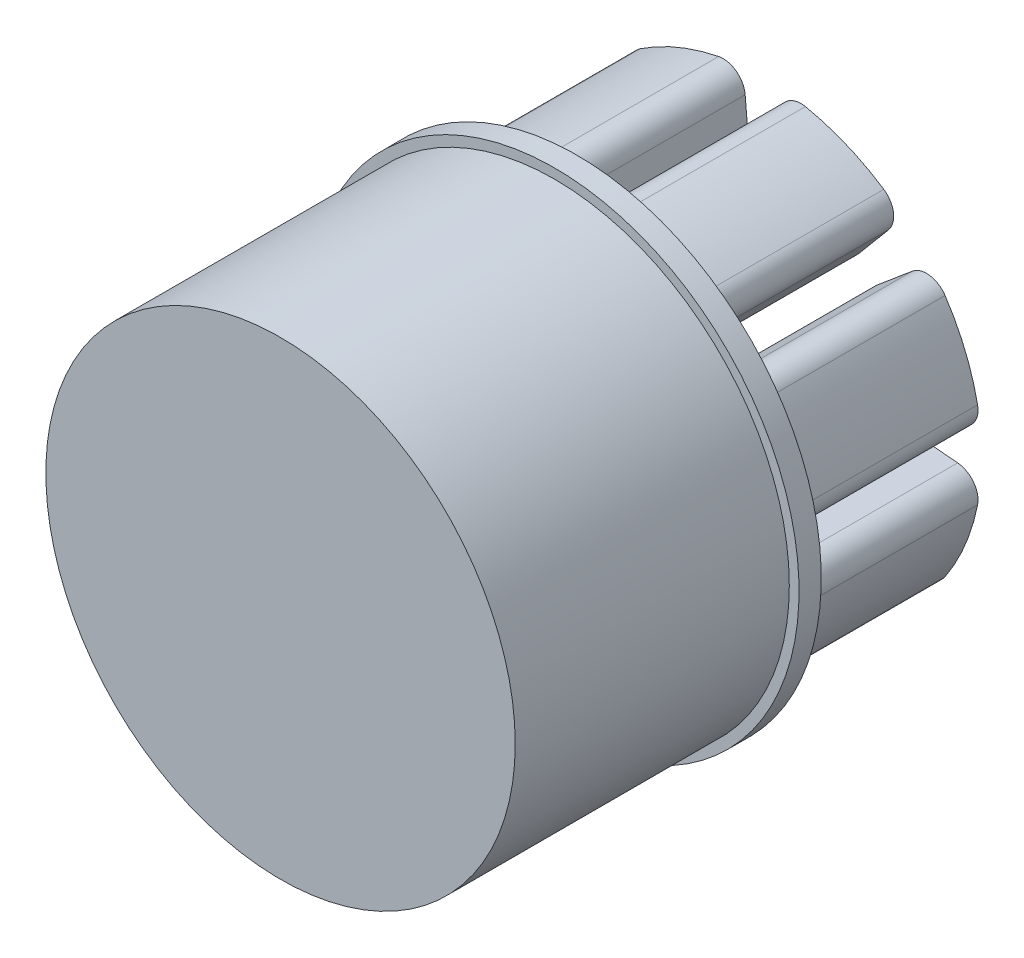
from build123d import *
from build123d.topology import SkipClean

# Parameters (mm, degrees)
BOSS_EXTRUDE1_DEPTH   = 25
BOSS_EXTRUDE1_2_DEPTH = 25
BOSS_EXTRUDE1_3_DEPTH = 25
BOSS_EXTRUDE1_4_DEPTH = 25
BOSS_EXTRUDE1_5_DEPTH = 25
BOSS_EXTRUDE1_6_DEPTH = 25
BOSS_EXTRUDE1_7_DEPTH = 25
BOSS_EXTRUDE1_8_DEPTH = 25
BOSS_EXTRUDE2_START   = -3
SKETCH6_R             = 33
SKETCH6_R_2           = 31.685
BOSS_EXTRUDE2_DEPTH   = 3


with BuildPart() as part:
    # Sketch1 → Boss-Extrude1 (new body)
    with BuildSketch(Plane(origin=(0, 0, 0), x_dir=(-1, 0, 0), z_dir=(0, 0, 1))):
        with BuildLine():
            Line((-1.738225696, 20.20466707), (-2.272785403, 26.41824505))
            ThreePointArc((-2.272785403, 26.41824505), (-3.462351882, 28.561557475), (-5.853284272, 29.102204182))
            ThreePointArc((-5.853284272, 29.102204182), (-11.35995769, 27.425363923), (-16.439468924, 24.717262925))
            ThreePointArc((-16.439468924, 24.717262925), (-17.747818477, 22.644323466), (-17.073418251, 20.287622193))
            Line((-17.073418251, 20.287622193), (-13.05774592, 15.515968274))
            ThreePointArc((-13.05774592, 15.515968274), (-11.238150281, 14.485616628), (-9.187418979, 14.894338942))
            ThreePointArc((-9.187418979, 14.894338942), (-6.696960066, 16.167891819), (-4.035401805, 17.028374328))
            ThreePointArc((-4.035401805, 17.028374328), (-2.296305475, 18.189450019), (-1.738225696, 20.20466707))
        make_face()
    extrude(amount=BOSS_EXTRUDE1_DEPTH)



with BuildPart() as body_2:
    # Sketch1 → Boss-Extrude1 2 (new body)
    with BuildSketch(Plane(origin=(0, 0, 0), x_dir=(-1, 0, 0), z_dir=(0, 0, 1))):
        with BuildLine():
            Line((1.738225696, 20.20466707), (2.272785403, 26.41824505))
            ThreePointArc((2.272785403, 26.41824505), (3.462351882, 28.561557475), (5.853284272, 29.102204182))
            ThreePointArc((5.853284272, 29.102204182), (11.35995769, 27.425363923), (16.439468924, 24.717262925))
            ThreePointArc((16.439468924, 24.717262925), (17.747818477, 22.644323466), (17.073418251, 20.287622193))
            Line((17.073418251, 20.287622193), (13.05774592, 15.515968274))
            ThreePointArc((13.05774592, 15.515968274), (11.238150281, 14.485616628), (9.187418979, 14.894338942))
            ThreePointArc((9.187418979, 14.894338942), (6.696960066, 16.167891819), (4.035401805, 17.028374328))
            ThreePointArc((4.035401805, 17.028374328), (2.296305475, 18.189450019), (1.738225696, 20.20466707))
        make_face()
    extrude(amount=BOSS_EXTRUDE1_2_DEPTH)


with BuildPart() as body_3:
    # Sketch1 → Boss-Extrude1 3 (new body)
    with BuildSketch(Plane(origin=(0, 0, 0), x_dir=(-1, 0, 0), z_dir=(0, 0, 1))):
        with BuildLine():
            Line((15.515968274, 13.05774592), (20.287622193, 17.073418251))
            ThreePointArc((20.287622193, 17.073418251), (22.644323466, 17.747818477), (24.717262925, 16.439468924))
            ThreePointArc((24.717262925, 16.439468924), (27.425363923, 11.35995769), (29.102204182, 5.853284272))
            ThreePointArc((29.102204182, 5.853284272), (28.561557475, 3.462351882), (26.41824505, 2.272785403))
            Line((26.41824505, 2.272785403), (20.20466707, 1.738225696))
            ThreePointArc((20.20466707, 1.738225696), (18.189450019, 2.296305475), (17.028374328, 4.035401805))
            ThreePointArc((17.028374328, 4.035401805), (16.167891819, 6.696960066), (14.894338942, 9.187418979))
            ThreePointArc((14.894338942, 9.187418979), (14.485616628, 11.238150281), (15.515968274, 13.05774592))
        make_face()
    extrude(amount=BOSS_EXTRUDE1_3_DEPTH)


with BuildPart() as body_4:
    # Sketch1 → Boss-Extrude1 4 (new body)
    with BuildSketch(Plane(origin=(0, 0, 0), x_dir=(-1, 0, 0), z_dir=(0, 0, 1))):
        with BuildLine():
            Line((20.20466707, -1.738225696), (26.41824505, -2.272785403))
            ThreePointArc((26.41824505, -2.272785403), (28.561557475, -3.462351882), (29.102204182, -5.853284272))
            ThreePointArc((29.102204182, -5.853284272), (27.425363923, -11.35995769), (24.717262925, -16.439468924))
            ThreePointArc((24.717262925, -16.439468924), (22.644323466, -17.747818477), (20.287622193, -17.073418251))
            Line((20.287622193, -17.073418251), (15.515968274, -13.05774592))
            ThreePointArc((15.515968274, -13.05774592), (14.485616628, -11.238150281), (14.894338942, -9.187418979))
            ThreePointArc((14.894338942, -9.187418979), (16.167891819, -6.696960066), (17.028374328, -4.035401805))
            ThreePointArc((17.028374328, -4.035401805), (18.189450019, -2.296305475), (20.20466707, -1.738225696))
        make_face()
    extrude(amount=BOSS_EXTRUDE1_4_DEPTH)


with BuildPart() as body_5:
    # Sketch1 → Boss-Extrude1 5 (new body)
    with BuildSketch(Plane(origin=(0, 0, 0), x_dir=(-1, 0, 0), z_dir=(0, 0, 1))):
        with BuildLine():
            Line((13.05774592, -15.515968274), (17.073418251, -20.287622193))
            ThreePointArc((17.073418251, -20.287622193), (17.747818477, -22.644323466), (16.439468924, -24.717262925))
            ThreePointArc((16.439468924, -24.717262925), (11.35995769, -27.425363923), (5.853284272, -29.102204182))
            ThreePointArc((5.853284272, -29.102204182), (3.462351882, -28.561557475), (2.272785403, -26.41824505))
            Line((2.272785403, -26.41824505), (1.738225696, -20.20466707))
            ThreePointArc((1.738225696, -20.20466707), (2.296305475, -18.189450019), (4.035401805, -17.028374328))
            ThreePointArc((4.035401805, -17.028374328), (6.696960066, -16.167891819), (9.187418979, -14.894338942))
            ThreePointArc((9.187418979, -14.894338942), (11.238150281, -14.485616628), (13.05774592, -15.515968274))
        make_face()
    extrude(amount=BOSS_EXTRUDE1_5_DEPTH)


with BuildPart() as body_6:
    # Sketch1 → Boss-Extrude1 6 (new body)
    with BuildSketch(Plane(origin=(0, 0, 0), x_dir=(-1, 0, 0), z_dir=(0, 0, 1))):
        with BuildLine():
            Line((-1.738225696, -20.20466707), (-2.272785403, -26.41824505))
            ThreePointArc((-2.272785403, -26.41824505), (-3.462351882, -28.561557475), (-5.853284272, -29.102204182))
            ThreePointArc((-5.853284272, -29.102204182), (-11.35995769, -27.425363923), (-16.439468924, -24.717262925))
            ThreePointArc((-16.439468924, -24.717262925), (-17.747818477, -22.644323466), (-17.073418251, -20.287622193))
            Line((-17.073418251, -20.287622193), (-13.05774592, -15.515968274))
            ThreePointArc((-13.05774592, -15.515968274), (-11.238150281, -14.485616628), (-9.187418979, -14.894338942))
            ThreePointArc((-9.187418979, -14.894338942), (-6.696960066, -16.167891819), (-4.035401805, -17.028374328))
            ThreePointArc((-4.035401805, -17.028374328), (-2.296305475, -18.189450019), (-1.738225696, -20.20466707))
        make_face()
    extrude(amount=BOSS_EXTRUDE1_6_DEPTH)


with BuildPart() as body_7:
    # Sketch1 → Boss-Extrude1 7 (new body)
    with BuildSketch(Plane(origin=(0, 0, 0), x_dir=(-1, 0, 0), z_dir=(0, 0, 1))):
        with BuildLine():
            Line((-15.515968274, -13.05774592), (-20.287622193, -17.073418251))
            ThreePointArc((-20.287622193, -17.073418251), (-22.644323466, -17.747818477), (-24.717262925, -16.439468924))
            ThreePointArc((-24.717262925, -16.439468924), (-27.425363923, -11.35995769), (-29.102204182, -5.853284272))
            ThreePointArc((-29.102204182, -5.853284272), (-28.561557475, -3.462351882), (-26.41824505, -2.272785403))
            Line((-26.41824505, -2.272785403), (-20.20466707, -1.738225696))
            ThreePointArc((-20.20466707, -1.738225696), (-18.189450019, -2.296305475), (-17.028374328, -4.035401805))
            ThreePointArc((-17.028374328, -4.035401805), (-16.167891819, -6.696960066), (-14.894338942, -9.187418979))
            ThreePointArc((-14.894338942, -9.187418979), (-14.485616628, -11.238150281), (-15.515968274, -13.05774592))
        make_face()
    extrude(amount=BOSS_EXTRUDE1_7_DEPTH)


with BuildPart() as body_8:
    # Sketch1 → Boss-Extrude1 8 (new body)
    with BuildSketch(Plane(origin=(0, 0, 0), x_dir=(-1, 0, 0), z_dir=(0, 0, 1))):
        with BuildLine():
            Line((-20.20466707, 1.738225696), (-26.41824505, 2.272785403))
            ThreePointArc((-26.41824505, 2.272785403), (-28.561557475, 3.462351882), (-29.102204182, 5.853284272))
            ThreePointArc((-29.102204182, 5.853284272), (-27.425363923, 11.35995769), (-24.717262925, 16.439468924))
            ThreePointArc((-24.717262925, 16.439468924), (-22.644323466, 17.747818477), (-20.287622193, 17.073418251))
            Line((-20.287622193, 17.073418251), (-15.515968274, 13.05774592))
            ThreePointArc((-15.515968274, 13.05774592), (-14.485616628, 11.238150281), (-14.894338942, 9.187418979))
            ThreePointArc((-14.894338942, 9.187418979), (-16.167891819, 6.696960066), (-17.028374328, 4.035401805))
            ThreePointArc((-17.028374328, 4.035401805), (-18.189450019, 2.296305475), (-20.20466707, 1.738225696))
        make_face()
    extrude(amount=BOSS_EXTRUDE1_8_DEPTH)


with BuildPart() as part_1:
    with SkipClean():  # the faces are left unmerged after this step: merging them gives an invalid solid
        add(part.part)

        add(body_2.part)  # Revolve1 merges body 2

        add(body_3.part)  # Revolve1 merges body 3

        add(body_4.part)  # Revolve1 merges body 4

        add(body_5.part)  # Revolve1 merges body 5

        add(body_6.part)  # Revolve1 merges body 6

        add(body_7.part)  # Revolve1 merges body 7

        add(body_8.part)  # Revolve1 merges body 8
        # Sketch5 → Revolve1 (revolve)
        with BuildSketch(Plane(origin=(0, 0, 0), x_dir=(1, 0, 0), z_dir=(0, 1, 0))):
            with BuildLine():
                Line((17.5, -25), (31.685, -25))
                Line((31.685, -25), (31.685, -65))
                Line((31.685, -65), (0, -65))
                Line((0, -65), (0, -55.202941459))
                ThreePointArc((0, -55.202941459), (12.374368671, -50.07731013), (17.5, -37.702941459))
                Line((17.5, -37.702941459), (17.5, -25))
            make_face()
        revolve(axis=Axis((0, 0, 65), (0, 0, -1)))

    # Sketch6 → Boss-Extrude2 (add)
    with SkipClean():  # the faces are left unmerged after this step: merging them gives an invalid solid
        with BuildSketch(Plane(origin=(0, 0, 25), x_dir=(-1, 0, 0), z_dir=(0, 0, -1)).offset(BOSS_EXTRUDE2_START)):
            Circle(SKETCH6_R)
            with Locations(Location((0, 0, 0), (0, 0, 180))):
                Circle(SKETCH6_R_2, mode=Mode.SUBTRACT)
        extrude(amount=BOSS_EXTRUDE2_DEPTH)


solid = part_1.part
